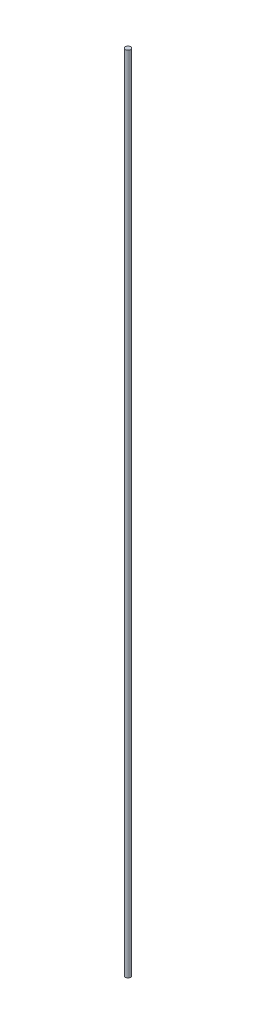
from build123d import *

# Parameters (mm, degrees)
SKETCH1_R           = 2
BOSS_EXTRUDE2_DEPTH = 622


with BuildPart() as part:
    # Sketch1 → Boss-Extrude2 (new body)
    with BuildSketch(Plane(origin=(0, 0, 0), x_dir=(1, 0, 0), z_dir=(0, 1, 0))):
        with Locations(Location((0, 0, 0), (0, 0, 270))):
            Circle(SKETCH1_R)
    extrude(amount=BOSS_EXTRUDE2_DEPTH)


solid = part.part
